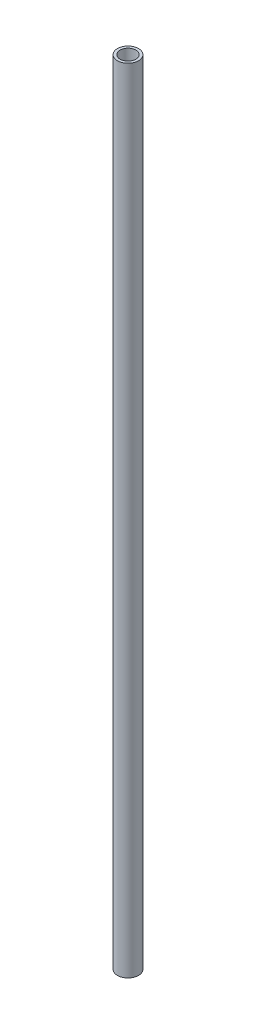
from build123d import *

# Parameters (mm, degrees)
SKETCH1_R           = 4
SKETCH1_R_2         = 3
BOSS_EXTRUDE1_DEPTH = 87.5
BOSS_EXTRUDE2_START = 87.5
SKETCH1_2_R         = 4
SKETCH1_2_R_2       = 3
BOSS_EXTRUDE2_DEPTH = 125


with BuildPart() as part:
    # Sketch1 → Boss-Extrude1 (new, symmetric)
    with BuildSketch(Plane(origin=(0, 0, 0), x_dir=(1, 0, 0), z_dir=(0, 1, 0))):
        with Locations(Location((0, 0, 0), (0, 0, 270))):
            Circle(SKETCH1_R)
        with Locations(Location((0, 0, 0), (0, 0, 270))):
            Circle(SKETCH1_R_2, mode=Mode.SUBTRACT)
    extrude(amount=BOSS_EXTRUDE1_DEPTH, both=True)

    # Sketch1<2> → Boss-Extrude2 (add)
    with BuildSketch(Plane(origin=(0, 0, 0), x_dir=(1, 0, 0), z_dir=(0, 1, 0)).offset(BOSS_EXTRUDE2_START)):
        with Locations(Location((0, 0, 0), (0, 0, 270))):
            Circle(SKETCH1_2_R)
        with Locations(Location((0, 0, 0), (0, 0, 270))):
            Circle(SKETCH1_2_R_2, mode=Mode.SUBTRACT)
    extrude(amount=BOSS_EXTRUDE2_DEPTH)


solid = part.part
